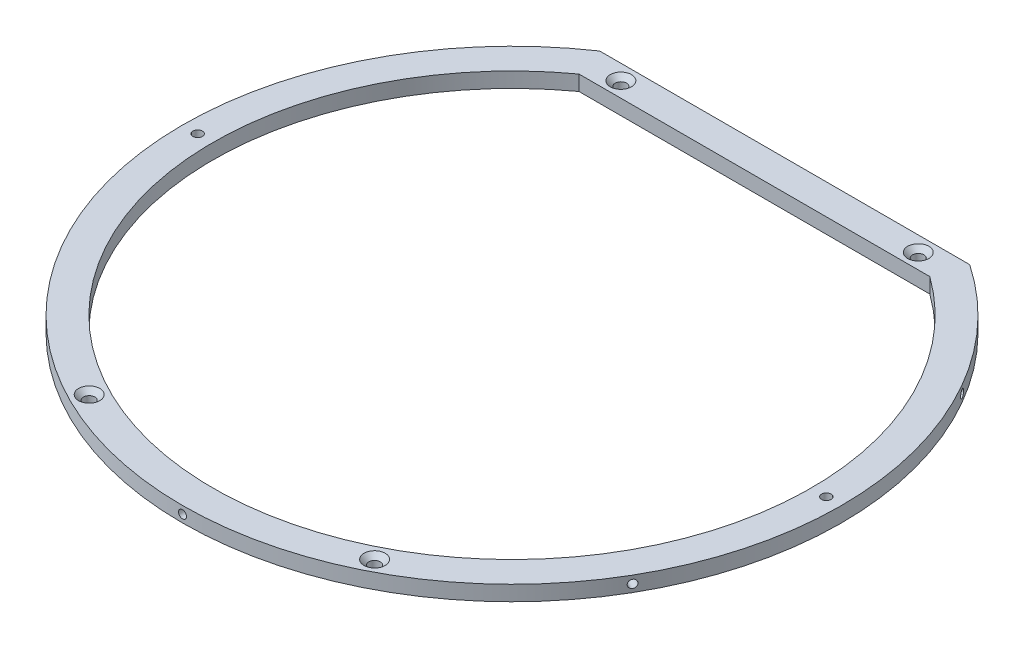
from build123d import *

# Parameters (mm, degrees)
BOSS_EXTRUDE1_DEPTH           = 2
CSK_FOR_M3_SFHCS1_D           = 3
CSK_FOR_M3_SFHCS1_DEPTH       = 9.5
CSK_FOR_M3_SFHCS1_CSINK_D     = 5.6
CSK_FOR_M3_SFHCS1_CSINK_ANGLE = 90
CSK_FOR_M3_SFHCS1_TIP         = 0.901290929
SKETCH6_R                     = 1.05
CUT_EXTRUDE1_DEPTH            = 6
SKETCH7_R                     = 1.05
CUT_EXTRUDE2_DEPTH            = 6
SKETCH8_R                     = 1.05
CUT_EXTRUDE3_DEPTH            = 6
M2_5X0_45_TAPPED_HOLE1_D      = 2.05
M2_5X0_45_TAPPED_HOLE1_DEPTH  = 6.35
M2_5X0_45_TAPPED_HOLE1_TIP    = 0.615882135
TAP_DRILL_FOR_M3X0_5_TAP1_D   = 2.5


with BuildPart() as part:
    # Sketch1 → Boss-Extrude1 (new, symmetric)
    with BuildSketch(Plane(origin=(0, 0, 0), x_dir=(1, 0, 0), z_dir=(0, 1, 0))):
        with BuildLine():
            Line((-48.836461788, 72), (48.836461788, 72))
            ThreePointArc((48.836461788, 72), (0, -87), (-48.836461788, 72))
        make_face()
        with BuildLine():
            Line((-46.314144708, 64), (46.314144708, 64))
            ThreePointArc((46.314144708, 64), (0, -79), (-46.314144708, 64))
        make_face(mode=Mode.SUBTRACT)
    extrude(amount=BOSS_EXTRUDE1_DEPTH, both=True)

    # CSK for M3 SFHCS1
    with Locations(Plane(origin=(-37.681211478, 2, 73.953541508), x_dir=(0, 0, 1), z_dir=(0, 1, 0))):
        with Locations((0, 0), (-141.953541508, -1.578606827), (-141.953541508, 76.941029783), (0, 75.362422956)):
            CounterSinkHole(CSK_FOR_M3_SFHCS1_D / 2, CSK_FOR_M3_SFHCS1_CSINK_D / 2, depth=CSK_FOR_M3_SFHCS1_DEPTH, counter_sink_angle=CSK_FOR_M3_SFHCS1_CSINK_ANGLE)
            with Locations((0, 0, -(CSK_FOR_M3_SFHCS1_DEPTH + CSK_FOR_M3_SFHCS1_TIP / 2))):  # 118° drill point
                Cone(0, CSK_FOR_M3_SFHCS1_D / 2, CSK_FOR_M3_SFHCS1_TIP, mode=Mode.SUBTRACT)

    # Sketch6 → Cut-Extrude1 (cut)
    with BuildSketch(Plane(origin=(75.344210129, 0, -43.5), x_dir=(-0.49999999999999784, 0, -0.86602540378444), z_dir=(0.86602540378444, 0, -0.49999999999999784))):
        Circle(SKETCH6_R)
    cut_extrude1 = extrude(amount=-CUT_EXTRUDE1_DEPTH, mode=Mode.SUBTRACT)

    # Sketch7 → Cut-Extrude2 (cut)
    with BuildSketch(Plane(origin=(75.344210129, 0, 43.5), x_dir=(0.5000000000000047, 0, -0.866025403784436), z_dir=(0.866025403784436, 0, 0.5000000000000047))):
        Circle(SKETCH7_R)
    cut_extrude2 = extrude(amount=-CUT_EXTRUDE2_DEPTH, mode=Mode.SUBTRACT)

    # Mirror1: Cut-Extrude1, Cut-Extrude2 across plane
    add(cut_extrude1.mirror(Plane(origin=(0, 0, 0), x_dir=(0, 0, 1), z_dir=(1, 0, 0))), mode=Mode.SUBTRACT)
    add(cut_extrude2.mirror(Plane(origin=(0, 0, 0), x_dir=(0, 0, 1), z_dir=(1, 0, 0))), mode=Mode.SUBTRACT)

    # Sketch8 → Cut-Extrude3 (cut)
    with BuildSketch(Plane.XY.offset(87)):
        Circle(SKETCH8_R)
    extrude(amount=-CUT_EXTRUDE3_DEPTH, mode=Mode.SUBTRACT)

    # M2.5x0.45 Tapped Hole1
    with Locations(Plane(origin=(33.836461788, 0, -72), x_dir=(-1, 0, 0), z_dir=(0, 0, -1))):
        with Locations((0, 0), (67.672923576, 0)):
            Hole(M2_5X0_45_TAPPED_HOLE1_D / 2, depth=M2_5X0_45_TAPPED_HOLE1_DEPTH)
            with Locations((0, 0, -(M2_5X0_45_TAPPED_HOLE1_DEPTH + M2_5X0_45_TAPPED_HOLE1_TIP / 2))):  # 118° drill point
                Cone(0, M2_5X0_45_TAPPED_HOLE1_D / 2, M2_5X0_45_TAPPED_HOLE1_TIP, mode=Mode.SUBTRACT)

    # Tap Drill for M3x0.5 Tap1 (through all)
    with Locations(Plane(origin=(-83, 2, 0), x_dir=(0, 0, 1), z_dir=(0, 1, 0))):
        with Locations((0, 0), (0, 166)):
            Hole(TAP_DRILL_FOR_M3X0_5_TAP1_D / 2)


solid = part.part
